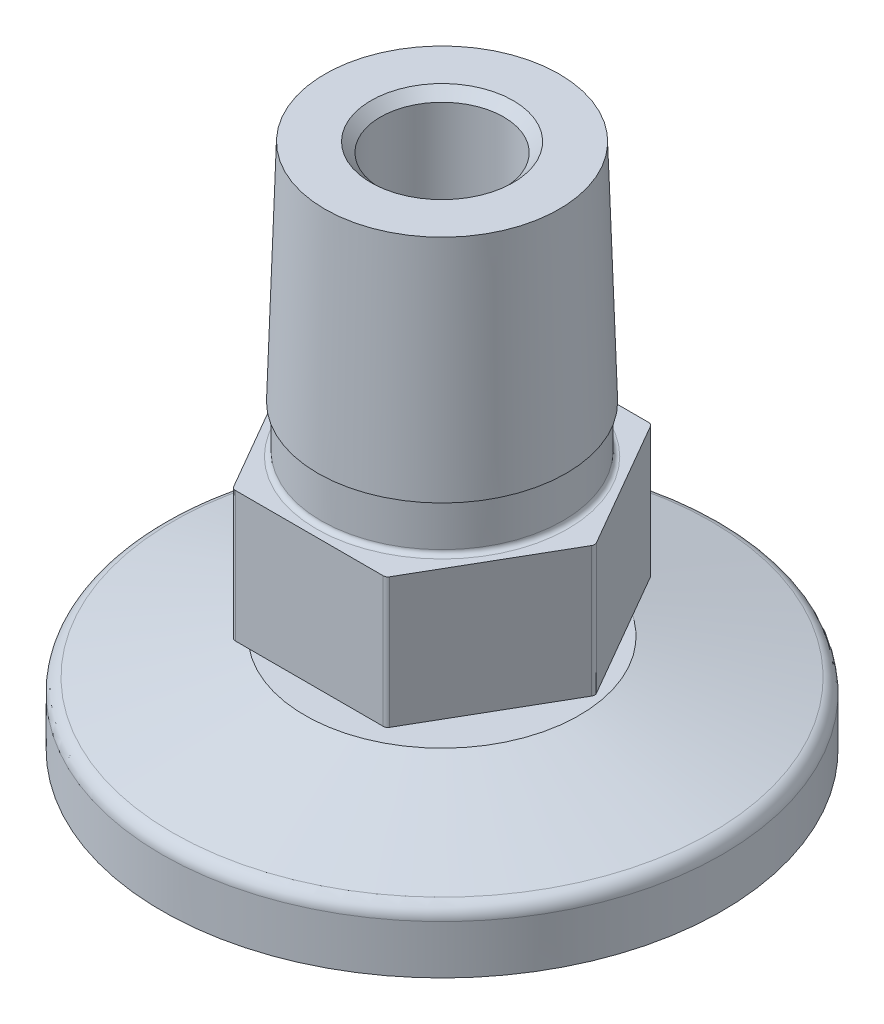
from build123d import *

# Parameters (mm, degrees)
SKETCH5_R         = 4.445
STUB_DEPTH        = 4.104
HEX_2_DEPTH       = 6.985
SKETCH11_W        = 15.24
SKETCH11_H        = 2.54
SKETCH3_R         = 3.302
CENTER_BORE_DEPTH = 36.283163634
FILLET1_R         = 0.254
FILLET2_R         = 0.762
CHAMFER1_SIZE     = 0.508
FILLET3_R         = 0.254


with BuildPart() as part:
    # Sketch1 → Flange (revolve)
    with BuildSketch(Plane(origin=(0, 0, 0), x_dir=(0, 0, -1), z_dir=(1, 0, 0)), mode=Mode.PRIVATE) as flange_sk:
        Polygon((-15, 0), (-15, 3.2), (-7.349295844, 5.25), (0, 5.25), (0, 2.5), (-8.1, 2.5), (-8.1, 0), align=None)
    revolve(flange_sk.sketch.rotate(Axis((0, 0, 0), (0, 1, 0)), 180), axis=Axis((0, 0, 0), (0, 1, 0)))

    # Sketch5 → Stub (add)
    with BuildSketch(Plane.XZ.offset(-2.5)):
        with Locations(Location((0, 0, 0), (0, 0, 270))):
            Circle(SKETCH5_R)
    extrude(amount=-STUB_DEPTH)

    # Sketch6 → Hex 2 (add)
    with BuildSketch(Plane(origin=(0, 6.604, 0), x_dir=(1, 0, 0), z_dir=(0, 1, 0))):
        Polygon((4.106115114, 7.112), (-4.106115114, 7.112), (-8.212230229, 0), (-4.106115114, -7.112), (4.106115114, -7.112), (8.212230229, 0), align=None)
    extrude(amount=HEX_2_DEPTH)

    # Sketch7 → Thread Body (revolve)
    with BuildSketch(Plane.XY, mode=Mode.PRIVATE) as thread_body_sk:
        Polygon((-6.731, 13.589), (-6.274596457, 28.194), (0, 28.194), (0, 13.589), align=None)
    revolve(thread_body_sk.sketch.rotate(Axis((0, 0, 0), (0, 1, 0)), 270), axis=Axis((0, 0, 0), (0, 1, 0)))

    # Sketch11 → Cut-Revolve1 (revolve, cut)
    with BuildSketch(Plane.XY, mode=Mode.PRIVATE) as cut_revolve1_sk:
        with Locations((-14.097, 14.859)):
            Rectangle(SKETCH11_W, SKETCH11_H)
    revolve(cut_revolve1_sk.sketch.rotate(Axis((0, 0, 0), (0, 1, 0)), 270), axis=Axis((0, 0, 0), (0, 1, 0)), mode=Mode.SUBTRACT)

    # Sketch3 → Center Bore (cut, through all)
    with BuildSketch(Plane(origin=(0, 0, 0), x_dir=(1, 0, 0), z_dir=(0, 1, 0))):
        with Locations(Location((0, 0, 0), (0, 0, 270))):
            Circle(SKETCH3_R)
    extrude(amount=CENTER_BORE_DEPTH, mode=Mode.SUBTRACT)

    # Fillet1
    fillet1_edges = [part.edges().sort_by_distance(p)[0] for p in [
        (8.212230229, 10.0965, 0),
        (4.106115114, 10.0965, -7.112),
        (-4.106115114, 10.0965, -7.112),
        (-8.212230229, 10.0965, 0),
        (-4.106115114, 10.0965, 7.112),
        (4.106115114, 10.0965, 7.112),
    ]]
    fillet(fillet1_edges, radius=FILLET1_R)

    # Fillet2
    fillet2_edges = [part.edges().sort_by_distance(p)[0] for p in [
        (0, 3.2, 15),
    ]]
    fillet(fillet2_edges, radius=FILLET2_R)

    # Chamfer1
    chamfer1_edges = [part.edges().sort_by_distance(p)[0] for p in [
        (0, 28.194, -3.302),
    ]]
    chamfer(chamfer1_edges, length=CHAMFER1_SIZE)

    # Fillet3
    fillet3_edges = [part.edges().sort_by_distance(p)[0] for p in [
        (0, 13.589, 6.477),
    ]]
    fillet(fillet3_edges, radius=FILLET3_R)


solid = part.part
